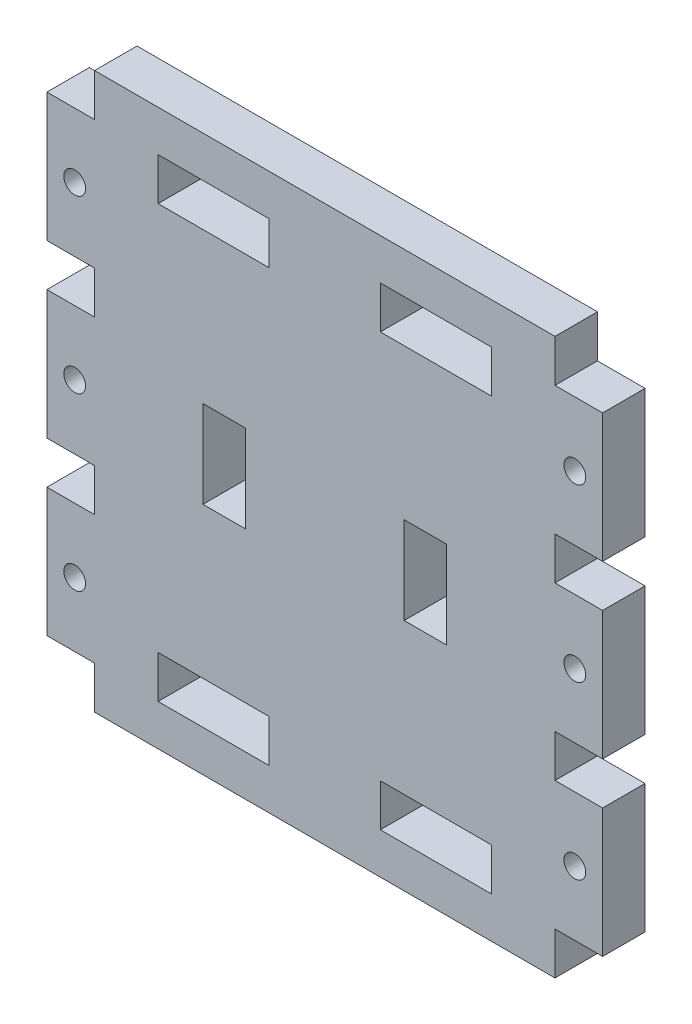
from build123d import *

# Parameters (mm, degrees)
MODEL_R             = 1.375
MODEL_W             = 5.349997431
MODEL_H             = 10.99999994
MODEL_W_2           = 5.350001157
MODEL_W_3           = 14.000000432
MODEL_H_2           = 5.350000225
MODEL_W_4           = 14.000002294
MODEL_H_3           = 5.349997431
BOSS_EXTRUDE1_DEPTH = 5.35


with BuildPart() as part:
    # Model → Boss-Extrude1 (new body)
    with BuildSketch(Plane.XY):
        Polygon((5.999997258, 5.350000225), (5.999997258, 0), (64.000000246, 0), (64.000000246, 5.350000225), (70.000000298, 5.350000225), (70.000000298, 21.549999714), (64.000000246, 21.549999714), (64.000000246, 26.90000087), (70.000000298, 26.90000087), (70.000000298, 43.099999428), (64.000000246, 43.099999428), (64.000000246, 48.450000584), (70.000000298, 48.450000584), (70.000000298, 64.649999142), (64.000000246, 64.649999142), (64.000000246, 70.000000298), (5.999997258, 70.000000298), (5.999997258, 64.649999142), (0, 64.649999142), (0, 48.450000584), (5.999997258, 48.450000584), (5.999997258, 43.099999428), (0, 43.099999428), (0, 26.90000087), (5.999997258, 26.90000087), (5.999997258, 21.549999714), (0, 21.549999714), (0, 5.350000225), align=None)
        with Locations((3.500000298, 35)):
            Circle(MODEL_R, mode=Mode.SUBTRACT)
        with Locations((3.500000298, 56.55)):
            Circle(MODEL_R, mode=Mode.SUBTRACT)
        with Locations((3.500000298, 13.45)):
            Circle(MODEL_R, mode=Mode.SUBTRACT)
        with Locations((66.500000298, 13.45)):
            Circle(MODEL_R, mode=Mode.SUBTRACT)
        with Locations((66.500000298, 56.55)):
            Circle(MODEL_R, mode=Mode.SUBTRACT)
        with Locations((66.500000298, 35)):
            Circle(MODEL_R, mode=Mode.SUBTRACT)
        with Locations((22.324999795, 35.000000149)):
            Rectangle(MODEL_W, MODEL_H, mode=Mode.SUBTRACT)
        with Locations((47.675000504, 35.000000149)):
            Rectangle(MODEL_W_2, MODEL_H, mode=Mode.SUBTRACT)
        with Locations((48.99999965, 7.844999899)):
            Rectangle(MODEL_W_3, MODEL_H_2, mode=Mode.SUBTRACT)
        with Locations((20.999999717, 7.844999899)):
            Rectangle(MODEL_W_4, MODEL_H_2, mode=Mode.SUBTRACT)
        with Locations((48.99999965, 62.154999003)):
            Rectangle(MODEL_W_3, MODEL_H_3, mode=Mode.SUBTRACT)
        with Locations((20.999999717, 62.154999003)):
            Rectangle(MODEL_W_4, MODEL_H_3, mode=Mode.SUBTRACT)
    extrude(amount=BOSS_EXTRUDE1_DEPTH)


solid = part.part
